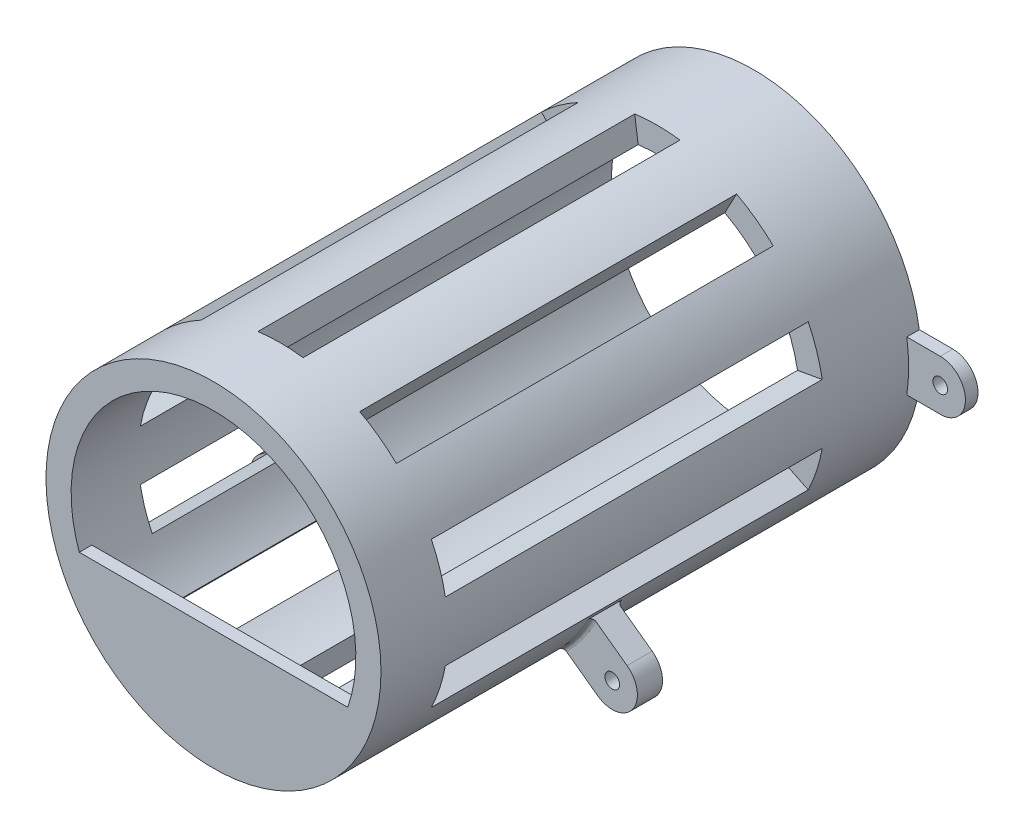
from build123d import *

# Parameters (mm, degrees)
SKETCH2_R           = 40
SKETCH2_R_2         = 34
BOSS_EXTRUDE1_DEPTH = 129
BOSS_EXTRUDE2_START = -3
BOSS_EXTRUDE2_DEPTH = 3
SKETCH4_R           = 1.75
BOSS_EXTRUDE3_DEPTH = 6
FILLET1_R           = 1
SKETCH5_R           = 1.75
BOSS_EXTRUDE4_DEPTH = 3
CUT_EXTRUDE1_DEPTH  = 45


with BuildPart() as part:
    # Sketch2 → Boss-Extrude1 (new body)
    with BuildSketch(Plane.XY):
        Circle(SKETCH2_R)
        Circle(SKETCH2_R_2, mode=Mode.SUBTRACT)
    extrude(amount=BOSS_EXTRUDE1_DEPTH)

    # Sketch3 → Boss-Extrude2 (add)
    with BuildSketch(Plane.XY.offset(129).offset(BOSS_EXTRUDE2_START)):
        with BuildLine():
            Line((-38.359258991, -11.338749917), (38.359258991, -11.338749917))
            ThreePointArc((38.359258991, -11.338749917), (0, -40), (-38.359258991, -11.338749917))
        make_face()
    extrude(amount=BOSS_EXTRUDE2_DEPTH)

    # Sketch4 → Boss-Extrude3 (add)
    # profile 1 of 2: a face of its own
    with BuildSketch(Plane.XY.offset(68)):
        with BuildLine():
            Line((-35.522508154, -18.388893781), (-43.756797007, -24.37476605))
            ThreePointArc((-43.756797007, -24.37476605), (-45.030952367, -32.827711895), (-36.559912698, -33.975427997))
            Line((-36.559912698, -33.975427997), (-28.469742754, -28.097575474))
            ThreePointArc((-28.469742754, -28.097575474), (-32.362272311, -23.509217998), (-35.522508154, -18.388893781))
        make_face()
        with Locations((-40.230085493, -29.228868016)):
            Circle(SKETCH4_R, mode=Mode.SUBTRACT)
    # profile 2 of 2: a face of its own
    with BuildSketch(Plane.XY.offset(68)):
        with BuildLine():
            Line((28.469742754, -28.097575474), (36.559912698, -33.975427997))
            ThreePointArc((36.559912698, -33.975427997), (45.030952367, -32.827711895), (43.756797007, -24.37476605))
            Line((43.756797007, -24.37476605), (35.522508154, -18.388893781))
            ThreePointArc((35.522508154, -18.388893781), (32.362272311, -23.509217998), (28.469742754, -28.097575474))
        make_face()
        with Locations(Location((40.230085493, -29.228868016, 0), (0, 0, 180))):
            Circle(SKETCH4_R, mode=Mode.SUBTRACT)
    extrude(amount=BOSS_EXTRUDE3_DEPTH)

    # Fillet1
    fillet1_edges = [part.edges().sort_by_distance(p)[0] for p in [
        (-32.362272311, -23.509217998, 74),
        (-32.362272311, -23.509217998, 68),
        (32.362272311, -23.509217998, 74),
        (32.362272311, -23.509217998, 68),
    ]]
    fillet(fillet1_edges, radius=FILLET1_R)

    # Sketch5 → Boss-Extrude4 (add)
    # profile 1 of 2: a face of its own
    with BuildSketch(Plane(origin=(0, 0, 0), x_dir=(-1, 0, 0), z_dir=(0, 0, -1))):
        with BuildLine():
            Line((-39.547439867, 6), (-47.547439867, 6))
            ThreePointArc((-47.547439867, 6), (-53.555028976, 0.287066347), (-48.151184551, -6))
            Line((-48.151184551, -6), (-39.547439867, -6))
            ThreePointArc((-39.547439867, -6), (-40, 0), (-39.547439867, 6))
        make_face()
        with Locations((-47.547439867, -0.015187819)):
            Circle(SKETCH5_R, mode=Mode.SUBTRACT)
    # profile 2 of 2: a face of its own
    with BuildSketch(Plane(origin=(0, 0, 0), x_dir=(-1, 0, 0), z_dir=(0, 0, -1))):
        with BuildLine():
            Line((39.547439867, -6), (48.151184551, -6))
            ThreePointArc((48.151184551, -6), (53.555028976, 0.287066347), (47.547439867, 6))
            Line((47.547439867, 6), (39.547439867, 6))
            ThreePointArc((39.547439867, 6), (40, 0), (39.547439867, -6))
        make_face()
        with Locations(Location((47.547439867, -0.015187819, 0), (0, 0, 180))):
            Circle(SKETCH5_R, mode=Mode.SUBTRACT)
    extrude(amount=-BOSS_EXTRUDE4_DEPTH)

    # Sketch6 → Cut-Extrude1 (cut, symmetric)
    with BuildSketch(Plane.XY.offset(68)):
        with BuildLine():
            Line((-5.405405405, 39.633087092), (-4.594594595, 33.688124028))
            ThreePointArc((-4.594594595, 33.688124028), (0, 34), (4.594594595, 33.688124028))
            Line((4.594594595, 33.688124028), (5.405405405, 39.633087092))
            ThreePointArc((5.405405405, 39.633087092), (0, 40), (-5.405405405, 39.633087092))
        make_face()
        with BuildLine():
            Line((18.922679261, 35.241058577), (16.084277372, 29.95489979))
            ThreePointArc((16.084277372, 29.95489979), (19.984698578, 27.506577809), (23.51848759, 24.553629904))
            Line((23.51848759, 24.553629904), (27.66880893, 28.886623417))
            ThreePointArc((27.66880893, 28.886623417), (23.511410092, 32.360679775), (18.922679261, 35.241058577))
        make_face()
        with BuildLine():
            Line((36.022943608, 17.388143485), (30.619502066, 14.779921962))
            ThreePointArc((30.619502066, 14.779921962), (32.335921554, 10.506577809), (33.45911769, 6.040483704))
            Line((33.45911769, 6.040483704), (39.363667871, 7.106451417))
            ThreePointArc((39.363667871, 7.106451417), (38.042260652, 12.360679775), (36.022943608, 17.388143485))
        make_face()
        with BuildLine():
            Line((39.363667871, -7.106451417), (33.45911769, -6.040483704))
            ThreePointArc((33.45911769, -6.040483704), (32.335921554, -10.506577809), (30.619502066, -14.779921962))
            Line((30.619502066, -14.779921962), (36.022943608, -17.388143485))
            ThreePointArc((36.022943608, -17.388143485), (38.042260652, -12.360679775), (39.363667871, -7.106451417))
        make_face()
        with BuildLine():
            Line((27.66880893, -28.886623417), (23.51848759, -24.553629904))
            ThreePointArc((23.51848759, -24.553629904), (19.984698578, -27.506577809), (16.084277372, -29.95489979))
            Line((16.084277372, -29.95489979), (18.922679261, -35.241058577))
            ThreePointArc((18.922679261, -35.241058577), (23.511410092, -32.360679775), (27.66880893, -28.886623417))
        make_face()
        with BuildLine():
            Line((5.405405405, -39.633087092), (4.594594595, -33.688124028))
            ThreePointArc((4.594594595, -33.688124028), (0, -34), (-4.594594595, -33.688124028))
            Line((-4.594594595, -33.688124028), (-5.405405405, -39.633087092))
            ThreePointArc((-5.405405405, -39.633087092), (0, -40), (5.405405405, -39.633087092))
        make_face()
        with BuildLine():
            Line((-18.922679261, -35.241058577), (-16.084277372, -29.95489979))
            ThreePointArc((-16.084277372, -29.95489979), (-19.984698578, -27.506577809), (-23.51848759, -24.553629904))
            Line((-23.51848759, -24.553629904), (-27.66880893, -28.886623417))
            ThreePointArc((-27.66880893, -28.886623417), (-23.511410092, -32.360679775), (-18.922679261, -35.241058577))
        make_face()
        with BuildLine():
            Line((-36.022943608, -17.388143485), (-30.619502066, -14.779921962))
            ThreePointArc((-30.619502066, -14.779921962), (-32.335921554, -10.506577809), (-33.45911769, -6.040483704))
            Line((-33.45911769, -6.040483704), (-39.363667871, -7.106451417))
            ThreePointArc((-39.363667871, -7.106451417), (-38.042260652, -12.360679775), (-36.022943608, -17.388143485))
        make_face()
        with BuildLine():
            Line((-39.363667871, 7.106451417), (-33.45911769, 6.040483704))
            ThreePointArc((-33.45911769, 6.040483704), (-32.335921554, 10.506577809), (-30.619502066, 14.779921962))
            Line((-30.619502066, 14.779921962), (-36.022943608, 17.388143485))
            ThreePointArc((-36.022943608, 17.388143485), (-38.042260652, 12.360679775), (-39.363667871, 7.106451417))
        make_face()
        with BuildLine():
            Line((-27.66880893, 28.886623417), (-23.51848759, 24.553629904))
            ThreePointArc((-23.51848759, 24.553629904), (-19.984698578, 27.506577809), (-16.084277372, 29.95489979))
            Line((-16.084277372, 29.95489979), (-18.922679261, 35.241058577))
            ThreePointArc((-18.922679261, 35.241058577), (-23.511410092, 32.360679775), (-27.66880893, 28.886623417))
        make_face()
    extrude(amount=CUT_EXTRUDE1_DEPTH, both=True, mode=Mode.SUBTRACT)


solid = part.part
